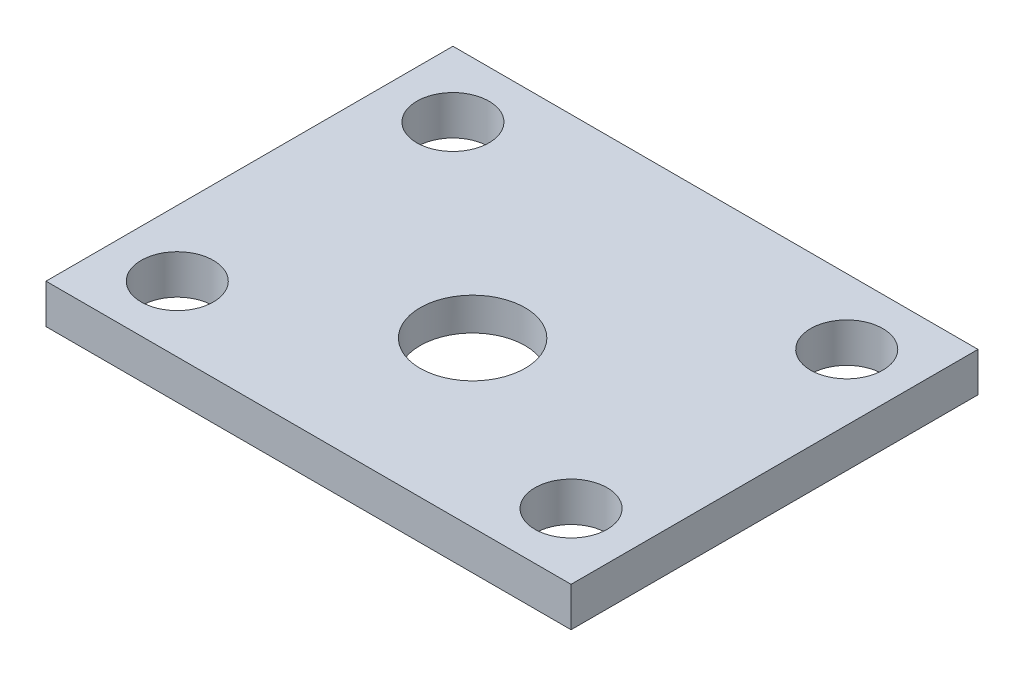
from build123d import *

# Parameters (mm, degrees)
SKETCH1_W           = 40
SKETCH1_H           = 31
BOSS_EXTRUDE1_DEPTH = 3
SKETCH2_R           = 2.75
CUT_EXTRUDE1_DEPTH  = 3
SKETCH3_R           = 8.725
CUT_EXTRUDE2_DEPTH  = 0.5
SKETCH4_R           = 4
CUT_EXTRUDE3_DEPTH  = 2.5


with BuildPart() as part:
    # Sketch1 → Boss-Extrude1 (new body)
    with BuildSketch(Plane(origin=(0, 0, 0), x_dir=(1, 0, 0), z_dir=(0, 1, 0))):
        Rectangle(SKETCH1_W, SKETCH1_H)
    extrude(amount=BOSS_EXTRUDE1_DEPTH)

    # Sketch2 → Cut-Extrude1 (cut)
    with BuildSketch(Plane(origin=(0, 3, 0), x_dir=(1, 0, 0), z_dir=(0, 1, 0))):
        with Locations(Location((-15, 10.5, 0), (0, 0, 270))):
            Circle(SKETCH2_R)
        with Locations(Location((15, 10.5, 0), (0, 0, 270))):
            Circle(SKETCH2_R)
        with Locations(Location((15, -10.5, 0), (0, 0, 270))):
            Circle(SKETCH2_R)
        with Locations(Location((-15, -10.5, 0), (0, 0, 270))):
            Circle(SKETCH2_R)
    extrude(amount=-CUT_EXTRUDE1_DEPTH, mode=Mode.SUBTRACT)

    # Sketch3 → Cut-Extrude2 (cut)
    with BuildSketch(Plane.XZ):
        with Locations(Location((0, 3, 0), (0, 0, 270))):
            Circle(SKETCH3_R)
    extrude(amount=-CUT_EXTRUDE2_DEPTH, mode=Mode.SUBTRACT)

    # Sketch4 → Cut-Extrude3 (cut)
    with BuildSketch(Plane(origin=(0, 3, 0), x_dir=(1, 0, 0), z_dir=(0, 1, 0))):
        with Locations(Location((0, -3, 0), (0, 0, 270))):
            Circle(SKETCH4_R)
    extrude(amount=-CUT_EXTRUDE3_DEPTH, mode=Mode.SUBTRACT)


solid = part.part
